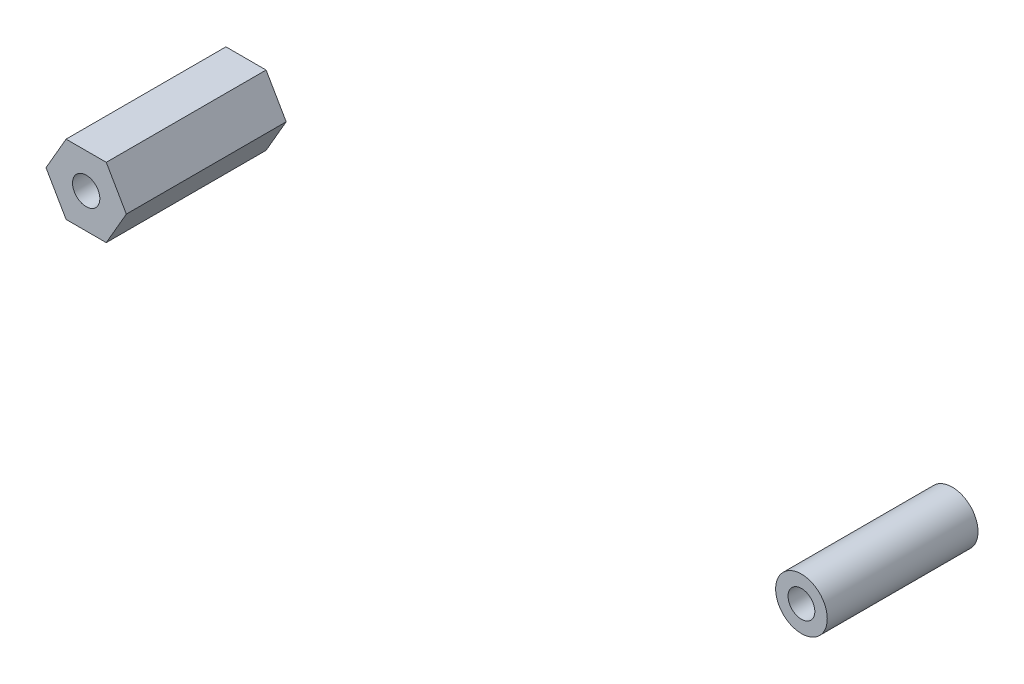
from build123d import *

# Parameters (mm, degrees)
BOSS_EXTRUDE1_DEPTH = 2.5
SKETCH2_R           = 1.65
BOSS_EXTRUDE2_DEPTH = 19.3
SKETCH3_R           = 3.1165
SKETCH3_R_2         = 1.6165
BOSS_EXTRUDE3_DEPTH = 18.2
CUT_EXTRUDE1_DEPTH  = 2.5


with BuildPart() as part:
    # Sketch1 → Boss-Extrude1 (new body)
    with BuildSketch(Plane.XY):
        Polygon((-38.330257739, 17.78), (-40.755128869, 21.98), (-45.604871131, 21.98), (-48.029742261, 17.78), (-45.604871131, 13.58), (-40.755128869, 13.58), align=None)
        Polygon((-41.505684219, 20.68), (-44.854315781, 20.68), (-46.528631561, 17.78), (-44.854315781, 14.88), (-41.505684219, 14.88), (-39.831368439, 17.78), align=None, mode=Mode.SUBTRACT)
    extrude(amount=BOSS_EXTRUDE1_DEPTH)

    # Sketch2 → Boss-Extrude2 (add)
    with BuildSketch(Plane.XY.offset(2.5)):
        Polygon((-40.755128869, 13.58), (-38.330257739, 17.78), (-40.755128869, 21.98), (-45.604871131, 21.98), (-48.029742261, 17.78), (-45.604871131, 13.58), align=None)
        with Locations(Location((-43.18, 17.78, 0), (0, 0, 180))):
            Circle(SKETCH2_R, mode=Mode.SUBTRACT)
    extrude(amount=BOSS_EXTRUDE2_DEPTH)

    # Sketch4 → Cut-Extrude1 (cut)
    with BuildSketch(Plane(origin=(0, 0, 0), x_dir=(-1, 0, 0), z_dir=(0, 0, -1))):
        Polygon((38.330257739, 17.78), (40.755128869, 13.58), (45.604871131, 13.58), (48.029742261, 17.78), (45.604871131, 21.98), (40.755128869, 21.98), align=None)
    extrude(amount=-CUT_EXTRUDE1_DEPTH, mode=Mode.SUBTRACT)


with BuildPart() as body_2:
    # Sketch3 → Boss-Extrude3 (new body)
    with BuildSketch(Plane.XY.offset(21.8)):
        with Locations((43.18, 17.78)):
            Circle(SKETCH3_R)
        with Locations((43.18, 17.78)):
            Circle(SKETCH3_R_2, mode=Mode.SUBTRACT)
    extrude(amount=-BOSS_EXTRUDE3_DEPTH)


solid = Compound([part.part, body_2.part])
